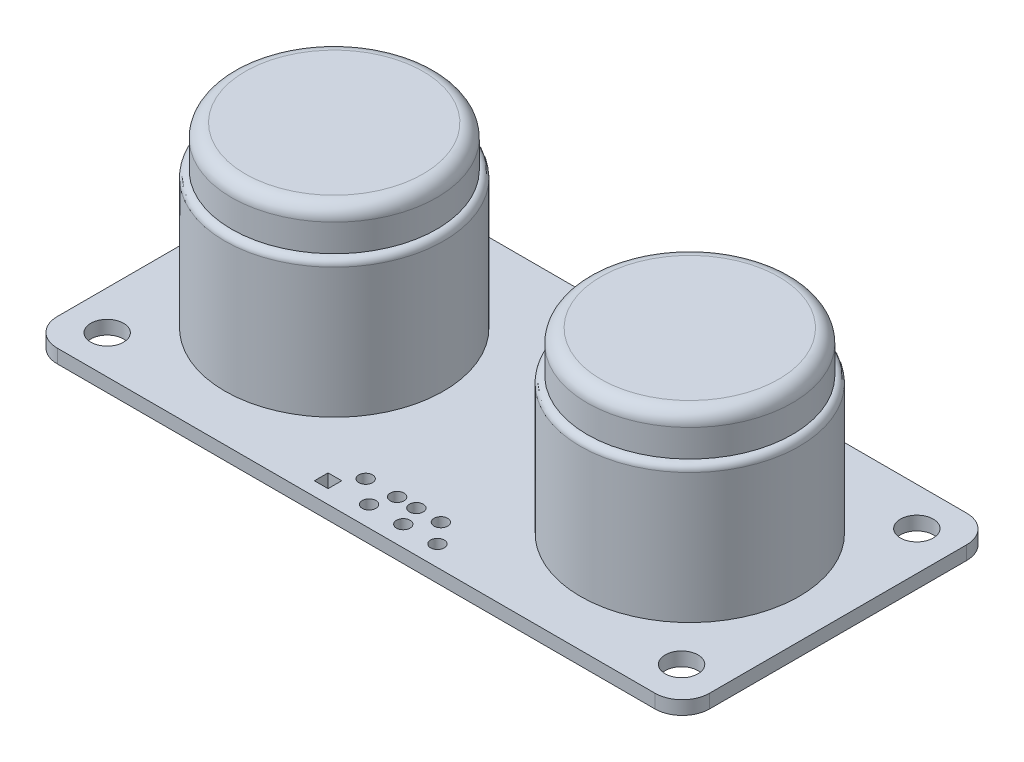
from build123d import *

# Parameters (mm, degrees)
SKETCH_1_W                  = 47.7
SKETCH_1_H                  = 22.8
EXTRUDE_1_DEPTH             = 1
SKETCH_2_W                  = 1
SKETCH_2_H                  = 1
CUT_EXTRUDE_1_DEPTH         = 27.453402428
HOLE_WIZARD_1_0_1_1_D       = 1
HOLE_WIZARD_2_4_2_4_1_D     = 2.4
HOLE_WIZARD_2_4_2_4_1_DEPTH = 14
FILLET_1_R                  = 1
FILLET_2_R                  = 2


with BuildPart() as part:
    # 草图1 → 凸台-拉伸1 (new body)
    with BuildSketch(Plane.XZ):
        Rectangle(SKETCH_1_W, SKETCH_1_H)
    extrude(amount=-EXTRUDE_1_DEPTH)

    # 草图2 → 切除-拉伸1 (cut, through all)
    with BuildSketch(Plane(origin=(0, 1, 0), x_dir=(-1, 0, 0), z_dir=(0, 1, 0))):
        with Locations((3.55, 9.9)):
            Rectangle(SKETCH_2_W, SKETCH_2_H)
    extrude(amount=-CUT_EXTRUDE_1_DEPTH, mode=Mode.SUBTRACT)

    # 草图3 → 旋转1 (revolve)
    with BuildSketch(Plane(origin=(0, 0, 0), x_dir=(-1, 0, 0), z_dir=(0, 0, -1)), mode=Mode.PRIVATE) as revolve_1_sk:
        with BuildLine():
            Line((-21, 1), (-13, 1))
            Line((-13, 1), (-13, 14))
            Line((-13, 14), (-20.5, 14))
            Line((-20.5, 14), (-20.5, 11))
            ThreePointArc((-20.5, 11), (-20.853553391, 10.853553391), (-21, 10.5))
            Line((-21, 10.5), (-21, 1))
        make_face()
    revolve(revolve_1_sk.sketch.rotate(Axis((13, 1, 0), (0, 1, 0)), 270), axis=Axis((13, 1, 0), (0, 1, 0)))

    # 草图4 → 旋转2 (revolve)
    with BuildSketch(Plane(origin=(0, 0, 0), x_dir=(-1, 0, 0), z_dir=(0, 0, -1)), mode=Mode.PRIVATE) as revolve_2_sk:
        with BuildLine():
            Line((5, 1), (13, 1))
            Line((13, 1), (13, 14))
            Line((13, 14), (5.5, 14))
            Line((5.5, 14), (5.5, 11))
            ThreePointArc((5.5, 11), (5.146446609, 10.853553391), (5, 10.5))
            Line((5, 10.5), (5, 1))
        make_face()
    revolve(revolve_2_sk.sketch.rotate(Axis((-13, 1, 0), (0, 1, 0)), 270), axis=Axis((-13, 1, 0), (0, 1, 0)))

    # Ø1.0 (1) 直径孔1 (through all)
    with Locations(Plane(origin=(0, 1, 0), x_dir=(1, 0, 0), z_dir=(0, 1, 0))):
        with Locations((-0.55, -9.9), (1.95, -9.9), (4.45, -9.9), (-2.3, -8.4), (0, -8.4), (3.2, -8.4), (1.407287445, -8.4)):
            Hole(HOLE_WIZARD_1_0_1_1_D / 2)

    # Ø2.4 (2.4) 直径孔1
    with Locations(Plane(origin=(0, 0, 0), x_dir=(-1, 0, 0), z_dir=(0, -1, 0))):
        with Locations((21, 8.6), (-21, 8.6), (-21, -8.6), (21, -8.6)):
            Hole(HOLE_WIZARD_2_4_2_4_1_D / 2, depth=HOLE_WIZARD_2_4_2_4_1_DEPTH)

    # 圆角1
    fillet_1_edges = [part.edges().sort_by_distance(p)[0] for p in [
        (13, 14, -7.5),
        (-13, 14, -7.5),
    ]]
    fillet(fillet_1_edges, radius=FILLET_1_R)

    # 圆角2
    fillet_2_edges = [part.edges().sort_by_distance(p)[0] for p in [
        (-23.85, 0.5, 11.4),
        (23.85, 0.5, 11.4),
        (23.85, 0.5, -11.4),
        (-23.85, 0.5, -11.4),
    ]]
    fillet(fillet_2_edges, radius=FILLET_2_R)


solid = part.part
